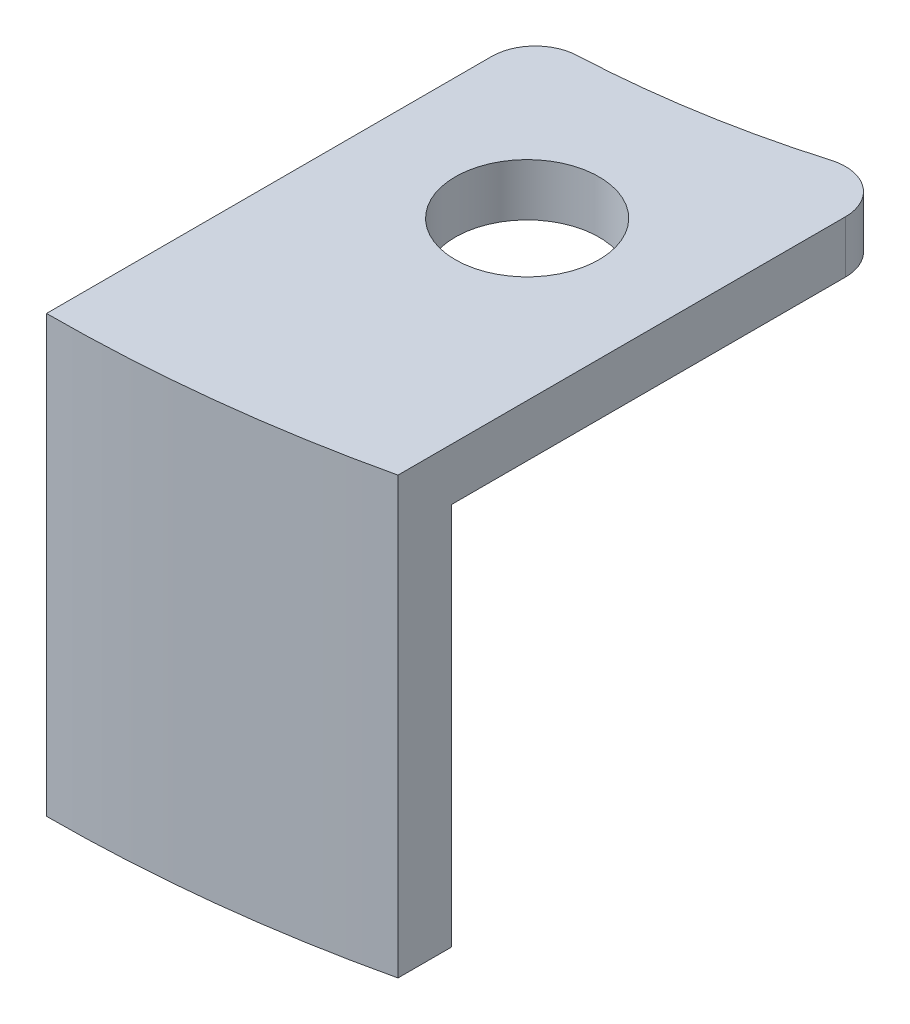
from build123d import *

# Parameters (mm, degrees)
BOSS_EXTRUDE1_DEPTH = 2.4
BOSS_EXTRUDE3_DEPTH = 20
FILLET2_R           = 2
SKETCH7_R           = 3.3
CUT_EXTRUDE1_DEPTH  = 34.346813941


with BuildPart() as part:
    # Sketch4 → Boss-Extrude1 (new body)
    with BuildSketch(Plane(origin=(0, 0, 0), x_dir=(1, 0, 0), z_dir=(0, 1, 0))):
        with BuildLine():
            Line((0, 0), (0, -20))
            ThreePointArc((0, -20), (7.299964439, -19.572220189), (14.5, -18.294736614))
            Line((14.5, -18.294736614), (14.5, 2.550031289))
            ThreePointArc((14.5, 2.550031289), (7.361261094, 0.642362285), (0, 0))
        make_face()
    extrude(amount=-BOSS_EXTRUDE1_DEPTH)

    # Sketch6 → Boss-Extrude3 (add)
    with BuildSketch(Plane(origin=(0, 0, 0), x_dir=(1, 0, 0), z_dir=(0, 1, 0))):
        with BuildLine():
            Line((0, -20), (0, -22.4))
            ThreePointArc((0, -22.4), (7.296255081, -21.988562256), (14.5, -20.759465695))
            Line((14.5, -20.759465695), (14.5, -18.294736614))
            ThreePointArc((14.5, -18.294736614), (7.299964439, -19.572220189), (0, -20))
        make_face()
    extrude(amount=-BOSS_EXTRUDE3_DEPTH)

    # Fillet2
    fillet2_edges = [part.edges().sort_by_distance(p)[0] for p in [
        (14.5, -1.2, -2.550031289),
        (0, -1.2, 0),
    ]]
    fillet(fillet2_edges, radius=FILLET2_R)

    # Sketch7 → Cut-Extrude1 (cut, through all)
    with BuildSketch(Plane(origin=(0, 0, 0), x_dir=(1, 0, 0), z_dir=(0, 1, 0))):
        with Locations(Location((7.25, -7.57807584, 0), (0, 0, 270))):
            Circle(SKETCH7_R)
    extrude(amount=-CUT_EXTRUDE1_DEPTH, mode=Mode.SUBTRACT)


solid = part.part
